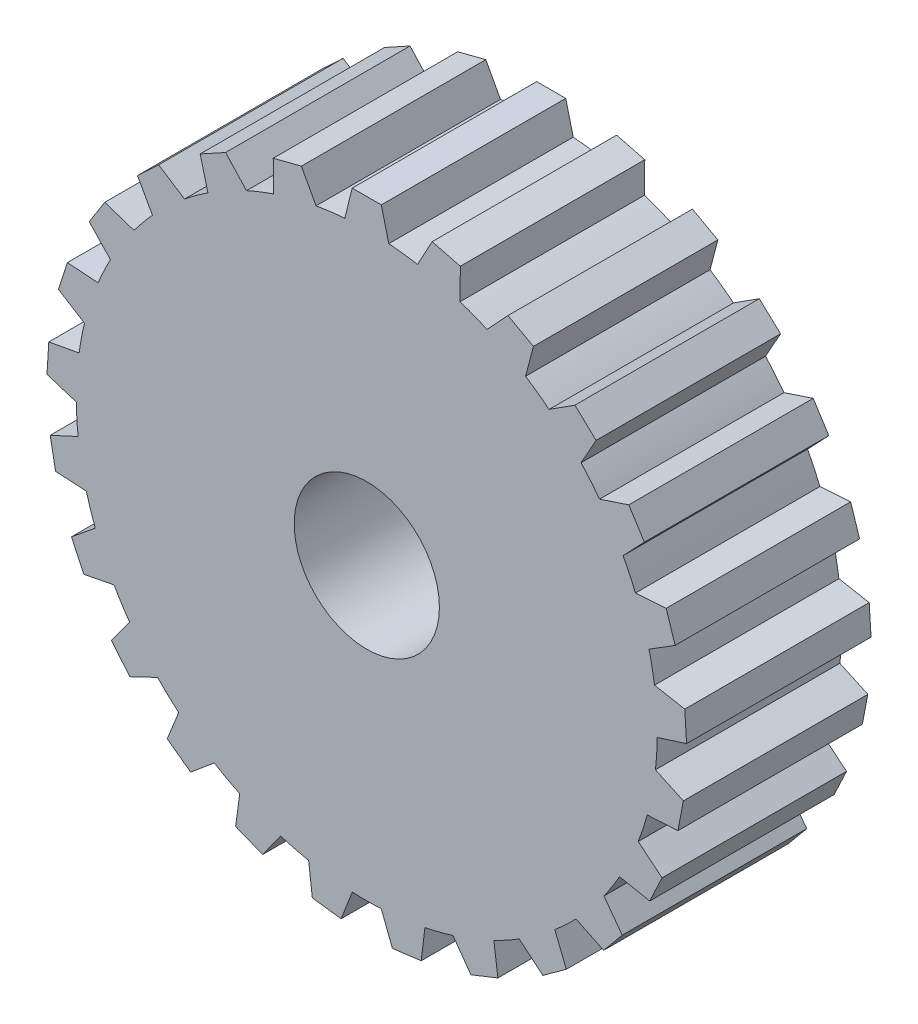
from build123d import *

# Parameters (mm, degrees)
SKETCH1_R           = 10
SKETCH1_R_2         = 2.5
BOSS_EXTRUDE1_DEPTH = 6.35
BOSS_EXTRUDE2_DEPTH = 6.35
CIRPATTERN1_COUNT   = 25


with BuildPart() as part:
    # Sketch1 → Boss-Extrude1 (new body)
    with BuildSketch(Plane.XY):
        Circle(SKETCH1_R)
        Circle(SKETCH1_R_2, mode=Mode.SUBTRACT)
    extrude(amount=BOSS_EXTRUDE1_DEPTH)

    # Sketch2 → Boss-Extrude2 (add)
    with BuildSketch(Plane.XY.offset(6.35)):
        Polygon((-0.5, 11), (0.5, 11), (1, 9), (-1, 9), align=None)
    boss_extrude2 = extrude(amount=-BOSS_EXTRUDE2_DEPTH)

    # CirPattern1: Boss-Extrude2 ×25 about axis
    cirpattern1_axis = Axis((0, 0, 0), (0, 0, 1))
    for i in range(1, CIRPATTERN1_COUNT):
        add(boss_extrude2.rotate(cirpattern1_axis, i * 360 / CIRPATTERN1_COUNT))


solid = part.part
